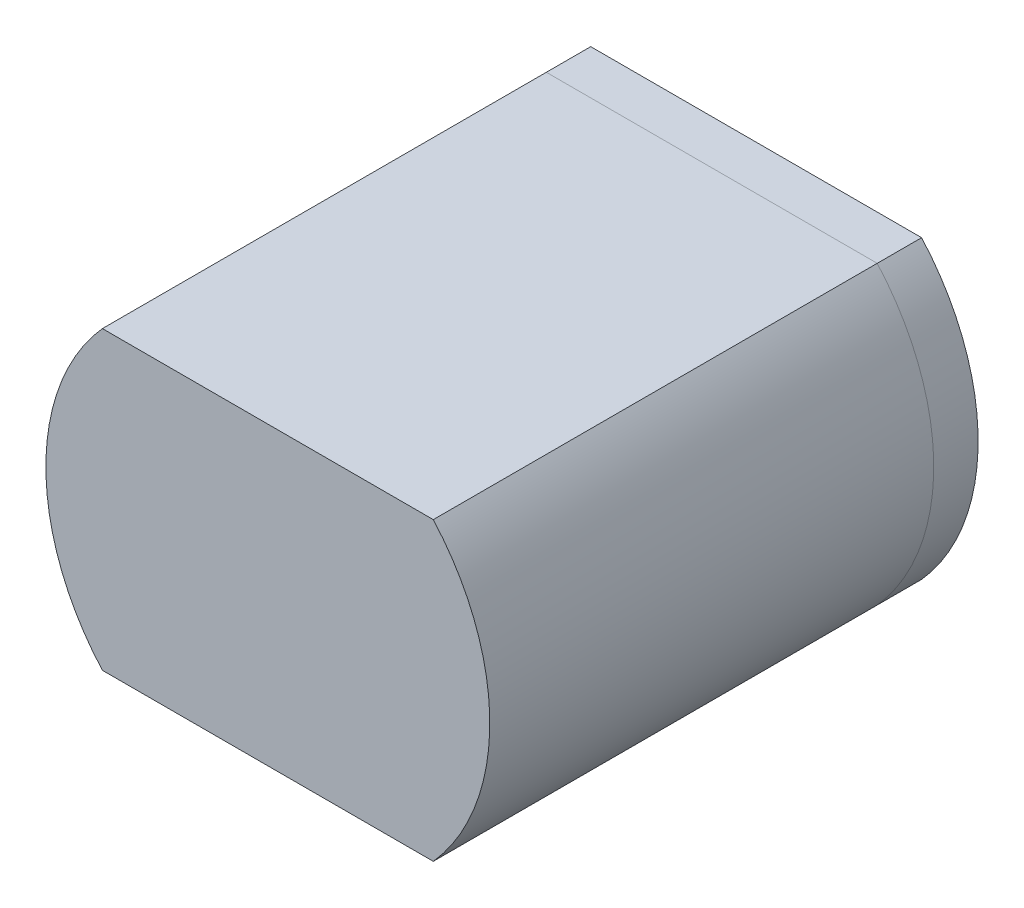
from build123d import *

# Parameters (mm, degrees)
BOSS_EXTRUDE1_DEPTH = 15
BOSS_EXTRUDE2_DEPTH = 1.5


with BuildPart() as part:
    # Sketch1 → Boss-Extrude1 (new body)
    with BuildSketch(Plane.XY):
        with BuildLine():
            Line((-5.590169944, -5), (5.590169944, -5))
            ThreePointArc((5.590169944, -5), (7.5, 0), (5.590169944, 5))
            Line((5.590169944, 5), (-5.590169944, 5))
            ThreePointArc((-5.590169944, 5), (-7.5, 0), (-5.590169944, -5))
        make_face()
    extrude(amount=BOSS_EXTRUDE1_DEPTH)


with BuildPart() as body_2:
    # Sketch2 → Boss-Extrude2 (new body)
    with BuildSketch(Plane(origin=(0, 0, 0), x_dir=(-1, 0, 0), z_dir=(0, 0, -1))):
        with BuildLine():
            Line((5.590169944, -5), (-5.590169944, -5))
            ThreePointArc((-5.590169944, -5), (-7.5, 0), (-5.590169944, 5))
            Line((-5.590169944, 5), (5.590169944, 5))
            ThreePointArc((5.590169944, 5), (7.5, 0), (5.590169944, -5))
        make_face()
    extrude(amount=BOSS_EXTRUDE2_DEPTH)


solid = Compound([part.part, body_2.part])
